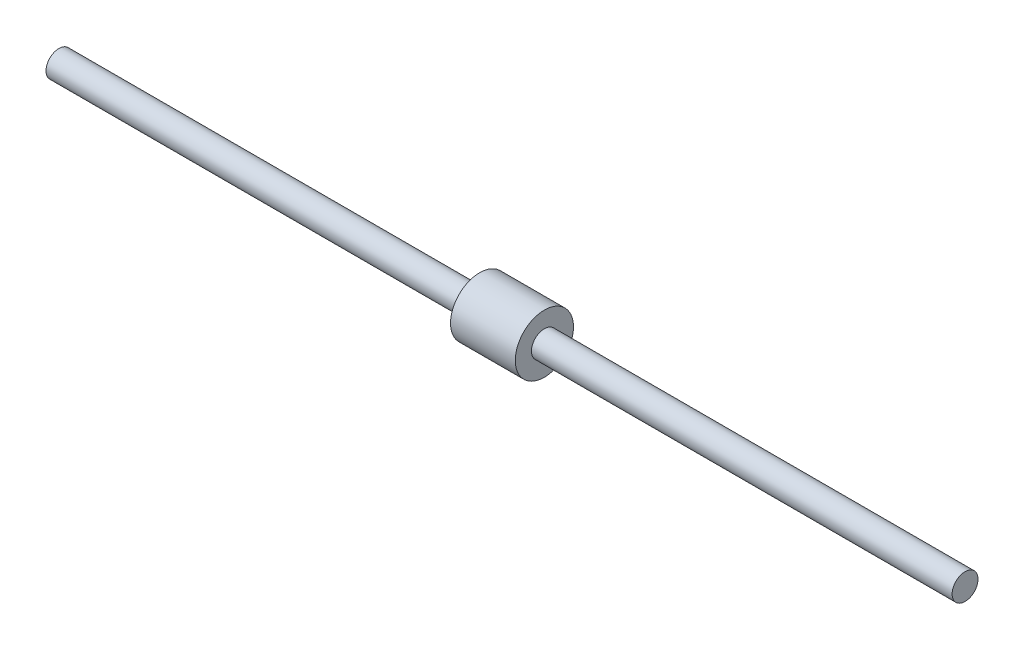
from build123d import *


with BuildPart() as part:
    # 草图1 → 旋转1 (revolve)
    with BuildSketch(Plane.XY, mode=Mode.PRIVATE) as revolve_1_sk:
        Polygon((0, 0), (0, 4), (130, 4), (130, 9), (150, 9), (150, 4), (280, 4), (280, 0), align=None)
    revolve(revolve_1_sk.sketch.rotate(Axis((0, 0, 0), (1, 0, 0)), 90), axis=Axis((0, 0, 0), (1, 0, 0)))


solid = part.part
